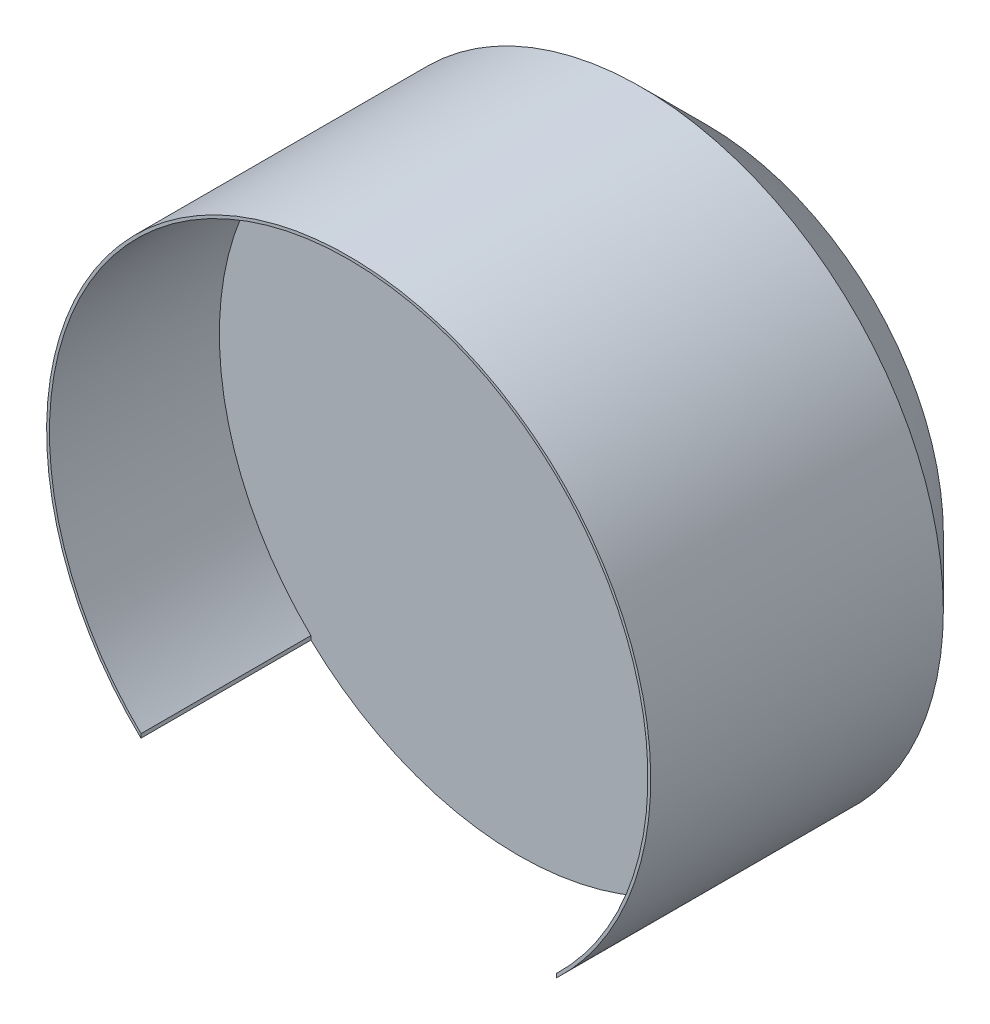
from build123d import *

# Parameters (mm, degrees)
ESQUISSE1_R             = 320
BOSS_EXTRU_1_DEPTH      = 200
CHANFREIN2_SIZE         = 70
ESQUISSE2_R             = 320
ESQUISSE2_R_2           = 317
BOSS_EXTRU_2_DEPTH      = 180
ESQUISSE3_W             = 440
ESQUISSE3_H             = 180
ENL_V_MAT_EXTRU_1_DEPTH = 591.931468108


with BuildPart() as part:
    # Esquisse1 → Boss.-Extru.1 (new body)
    with BuildSketch(Plane.XY):
        Circle(ESQUISSE1_R)
    extrude(amount=BOSS_EXTRU_1_DEPTH)

    # Chanfrein2
    chanfrein2_edges = [part.edges().sort_by_distance(p)[0] for p in [
        (-320, 0, 0),
    ]]
    chamfer(chanfrein2_edges, length=CHANFREIN2_SIZE)

    # Esquisse2 → Boss.-Extru.2 (add)
    with BuildSketch(Plane.XY.offset(200)):
        Circle(ESQUISSE2_R)
        with Locations(Location((0, 0, 0), (0, 0, 180))):
            Circle(ESQUISSE2_R_2, mode=Mode.SUBTRACT)
    extrude(amount=BOSS_EXTRU_2_DEPTH)

    # Esquisse3 → Enlèv. mat.-Extru.1 (cut, through all)
    with BuildSketch(Plane(origin=(0, 0, 0), x_dir=(1, 0, 0), z_dir=(0, 1, 0))):
        with Locations((0, -290)):
            Rectangle(ESQUISSE3_W, ESQUISSE3_H)
    extrude(amount=-ENL_V_MAT_EXTRU_1_DEPTH, mode=Mode.SUBTRACT)


solid = part.part
